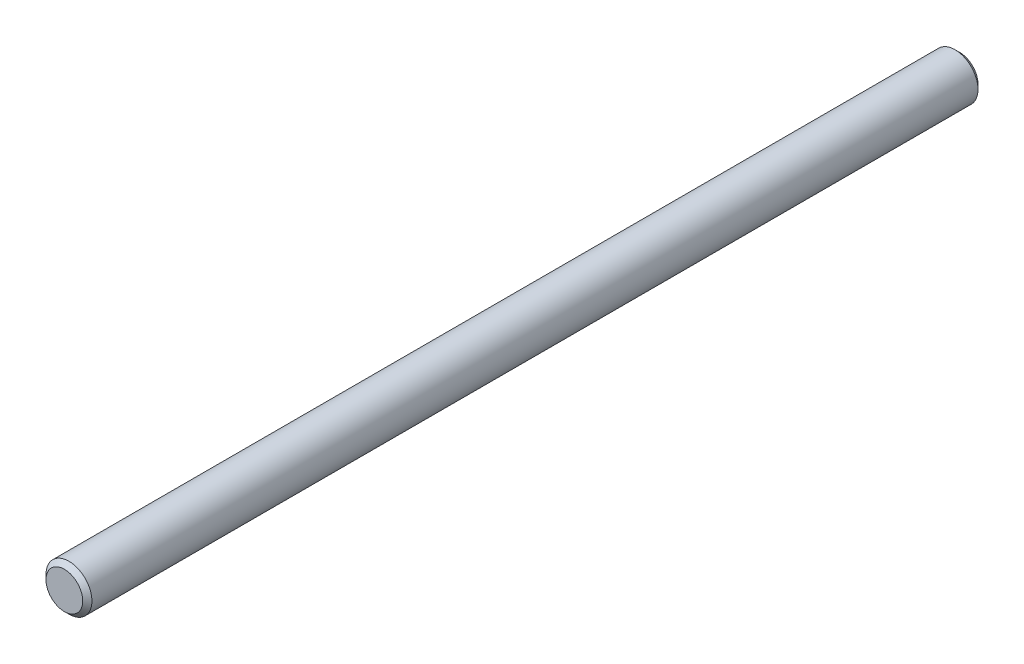
from build123d import *

# Parameters (mm, degrees)
SKETCH_1_R      = 0.5
EXTRUDE_1_DEPTH = 19.5
CHAMFER_1_SIZE  = 0.1


with BuildPart() as part:
    # Эскиз1 → Бобышка-Вытянуть1 (new body)
    with BuildSketch(Plane.XY):
        Circle(SKETCH_1_R)
    extrude(amount=EXTRUDE_1_DEPTH)

    # Фаска1
    chamfer_1_edges = [part.edges().sort_by_distance(p)[0] for p in [
        (-0.5, 0, 0),
        (-0.5, 0, 19.5),
    ]]
    chamfer(chamfer_1_edges, length=CHAMFER_1_SIZE)


solid = part.part
